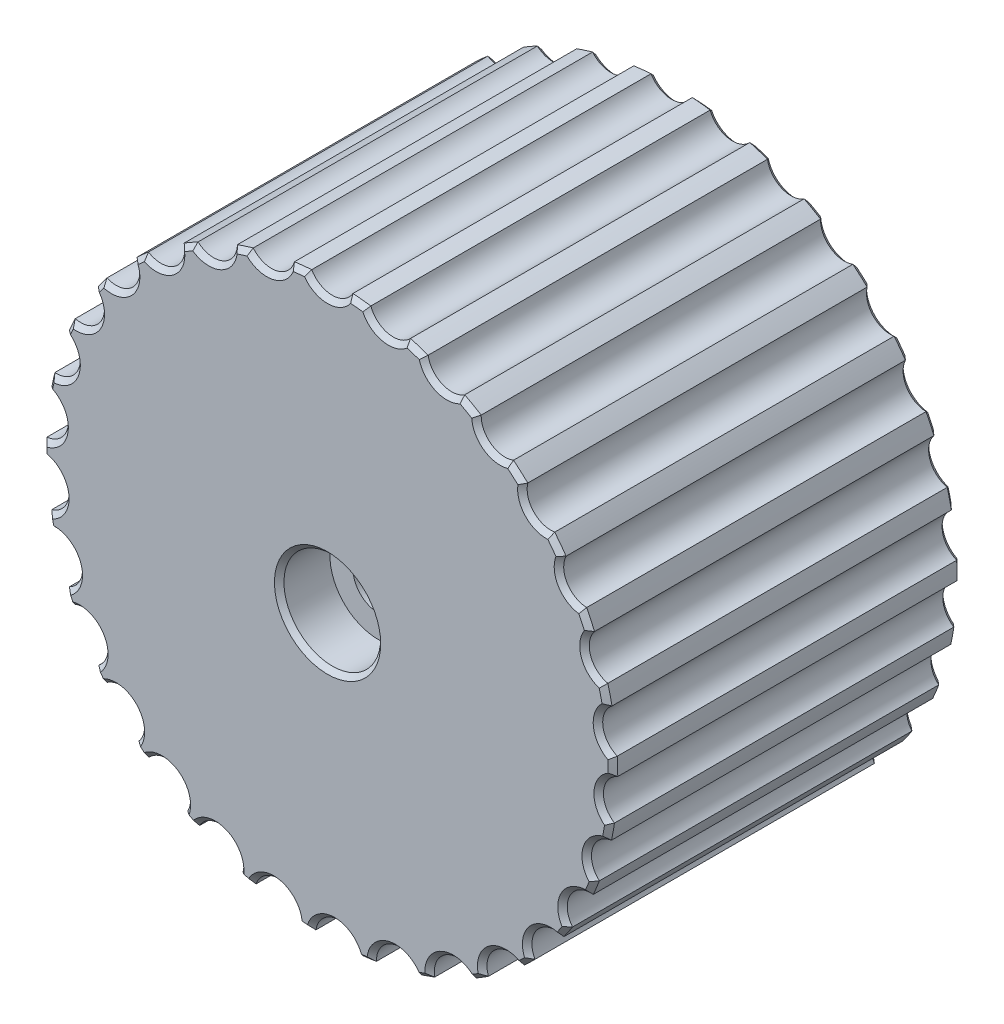
from build123d import *

# Parameters (mm, degrees)
SKIZZE1_R                       = 18
GRUNDK_RPER_DEPTH               = 14
SKIZZE3_R                       = 11.05
SITZ_KUGELLAGER_DEPTH           = 7.5
SITZ_SCHNECKENGEH_USE_START     = 8
SKIZZE4_R                       = 18
SKIZZE4_R_2                     = 15.6
SITZ_SCHNECKENGEH_USE_DEPTH     = 8
SKIZZE5_R                       = 1.6
BOHRUNG_M3_ZAPFEN_DEPTH         = 34.645207683
SKIZZE6_R                       = 3.05
SENKUNG_M3_DEPTH                = 3.2
SKIZZE7_R                       = 1.5
SCHNITT_LINEAR_AUSTRAGEN3_DEPTH = 34.645207683
FASE1_SIZE                      = 0.3
FREISCHNITTKUGELLAGER_DEPTH     = 7.5
FASE2_SIZE                      = 0.4


with BuildPart() as part:
    # Skizze1 → Grundkörper (new body)
    with BuildSketch(Plane.XY):
        Circle(SKIZZE1_R)
    extrude(amount=GRUNDK_RPER_DEPTH)

    # Skizze3 → Sitz_Kugellager (cut)
    with BuildSketch(Plane(origin=(0, 0, 0), x_dir=(-1, 0, 0), z_dir=(0, 0, -1))):
        Circle(SKIZZE3_R)
    extrude(amount=-SITZ_KUGELLAGER_DEPTH, mode=Mode.SUBTRACT)

    # Skizze4 → Sitz_SchneckenGehäuse (add)
    with BuildSketch(Plane(origin=(0, 0, 0), x_dir=(-1, 0, 0), z_dir=(0, 0, -1)).offset(SITZ_SCHNECKENGEH_USE_START)):
        Circle(SKIZZE4_R)
        Circle(SKIZZE4_R_2, mode=Mode.SUBTRACT)
    extrude(amount=-SITZ_SCHNECKENGEH_USE_DEPTH)

    # Skizze5 → Bohrung M3 Zapfen (cut, through all)
    with BuildSketch(Plane.XY.offset(14)):
        Circle(SKIZZE5_R)
    extrude(amount=-BOHRUNG_M3_ZAPFEN_DEPTH, mode=Mode.SUBTRACT)

    # Skizze6 → Senkung M3 (cut)
    with BuildSketch(Plane.XY.offset(14)):
        Circle(SKIZZE6_R)
    extrude(amount=-SENKUNG_M3_DEPTH, mode=Mode.SUBTRACT)

    # Skizze7 → Schnitt-Linear austragen3 (cut, through all)
    with BuildSketch(Plane.XY.offset(14)):
        with Locations((0, 18.7)):
            Circle(SKIZZE7_R)
        with Locations((3.840889693, 18.343624365)):
            Circle(SKIZZE7_R)
        with Locations((7.52375207, 17.196470523)):
            Circle(SKIZZE7_R)
        with Locations((10.887628372, 15.308674601)):
            Circle(SKIZZE7_R)
        with Locations((13.785501065, 12.762742339)):
            Circle(SKIZZE7_R)
        with Locations((16.090719205, 9.669943194)):
            Circle(SKIZZE7_R)
        with Locations((17.702533699, 6.16544733)):
            Circle(SKIZZE7_R)
        with Locations((18.550500518, 2.402418031)):
            Circle(SKIZZE7_R)
        with Locations((18.597559443, -1.454682263)):
            Circle(SKIZZE7_R)
        with Locations((17.841653775, -5.237279763)):
            Circle(SKIZZE7_R)
        with Locations((16.315820216, -8.780056806)):
            Circle(SKIZZE7_R)
        with Locations((14.086745017, -11.928177036)):
            Circle(SKIZZE7_R)
        with Locations((11.251849459, -14.544052492)):
            Circle(SKIZZE7_R)
        with Locations((7.935032082, -16.513356864)):
            Circle(SKIZZE7_R)
        with Locations((4.281253721, -17.750022102)):
            Circle(SKIZZE7_R)
        with Locations((0.450202022, -18.2)):
            Circle(SKIZZE7_R)
        with Locations((-3.390687671, -17.843624365)):
            Circle(SKIZZE7_R)
        with Locations((-7.073550047, -16.696470523)):
            Circle(SKIZZE7_R)
        with Locations((-10.43742635, -14.808674601)):
            Circle(SKIZZE7_R)
        with Locations((-13.335299043, -12.262742339)):
            Circle(SKIZZE7_R)
        with Locations((-15.640517183, -9.169943194)):
            Circle(SKIZZE7_R)
        with Locations((-17.252331677, -5.66544733)):
            Circle(SKIZZE7_R)
        with Locations((-18.100298496, -1.902418031)):
            Circle(SKIZZE7_R)
        with Locations((-18.147357421, 1.954682263)):
            Circle(SKIZZE7_R)
        with Locations((-17.391451752, 5.737279763)):
            Circle(SKIZZE7_R)
        with Locations((-15.865618194, 9.280056806)):
            Circle(SKIZZE7_R)
        with Locations((-13.636542995, 12.428177036)):
            Circle(SKIZZE7_R)
        with Locations((-10.801647437, 15.044052492)):
            Circle(SKIZZE7_R)
        with Locations((-7.48483006, 17.013356864)):
            Circle(SKIZZE7_R)
        with Locations((-3.831051698, 18.250022102)):
            Circle(SKIZZE7_R)
    extrude(amount=-SCHNITT_LINEAR_AUSTRAGEN3_DEPTH, mode=Mode.SUBTRACT)

    # Fase1
    fase1_edges = [part.edges().sort_by_distance(p)[0] for p in [
        (15.6, 0, -8),
        (17.102127152, -1.337711064, -8),
        (17.102127152, -1.337711064, 14),
        (16.402381555, -4.814792511, -8),
        (16.402381555, -4.814792511, 14),
        (14.994931633, -8.069245051, -8),
        (14.994931633, -8.069245051, 14),
        (12.942011218, -10.958855351, -8),
        (12.942011218, -10.958855351, 14),
        (10.33400092, -13.357648657, -8),
        (10.33400092, -13.357648657, 14),
        (7.285361892, -15.16134775, -8),
        (7.285361892, -15.16134775, 14),
        (3.929544005, -16.291838205, -8),
        (3.929544005, -16.291838205, 14),
        (0.413108807, -16.700458706, -8),
        (0.413108807, -16.700458706, 14),
        (-16.608515653, -1.745625337, -8),
        (-16.608515653, -1.745625337, 14),
        (3.533477918, 16.87546293, -8),
        (3.533477918, 16.87546293, 14),
        (6.92250395, 15.822243213, -8),
        (6.92250395, 15.822243213, 14),
        (10.018265281, 14.086296666, -8),
        (10.018265281, 14.086296666, 14),
        (12.684795951, 11.743699527, -8),
        (12.684795951, 11.743699527, 14),
        (14.805026945, 8.897288413, -8),
        (14.805026945, 8.897288413, 14),
        (16.285988352, 5.672092205, -8),
        (16.285988352, 5.672092205, 14),
        (17.062923496, 2.209766525, -8),
        (17.062923496, 2.209766525, 14),
        (-3.110664895, -16.369993731, -8),
        (-3.110664895, -16.369993731, 14),
        (-6.488412449, -15.315306525, -8),
        (-6.488412449, -15.315306525, 14),
        (-12.231166047, -11.247414644, -8),
        (-12.231166047, -11.247414644, 14),
        (-9.573272427, -13.582608535, -8),
        (-9.573272427, -13.582608535, 14),
        (-14.34651947, -8.411279949, -8),
        (-14.34651947, -8.411279949, 14),
        (-15.827206272, -5.197454187, -8),
        (-15.827206272, -5.197454187, 14),
        (-16.655983786, 1.794043911, -8),
        (-16.655983786, 1.794043911, 14),
        (-15.96696249, 5.267353874, -8),
        (-15.96696249, 5.267353874, 14),
        (-6.880792926, 15.640353171, -8),
        (-6.880792926, 15.640353171, 14),
        (-3.05, 0, 14),
        (-9.926795083, 13.825597175, -8),
        (-9.926795083, 13.825597175, 14),
        (-12.527901138, 11.417774526, -8),
        (-12.527901138, 11.417774526, 14),
        (-14.570842726, 8.522721684, -8),
        (-14.570842726, 8.522721684, 14),
        (-3.522887784, 16.782018355, -8),
        (-3.522887784, 16.782018355, 14),
        (0, 17.2, -8),
        (0, 17.2, 14),
        (17.515235554, 4.149279875, 14),
        (16.29626312, 7.644070142, 14),
        (14.391939436, 10.810739071, 14),
        (11.883403688, 13.519789821, 14),
        (8.874728972, 15.660114484, 14),
        (5.489353832, 17.142549242, 14),
        (1.866122968, 17.903004917, 14),
        (-1.845177718, 17.905175765, 14),
        (-5.488897258, 17.142695438, 14),
        (-8.909226545, 15.640514134, 14),
        (-11.956444307, 13.455238368, 14),
        (-14.493504933, 10.674189186, 14),
        (-16.402674498, 7.412979786, 14),
        (-17.591831713, 3.811490124, 14),
        (-17.99997786, 0.028231948, 14),
        (-17.601466242, -3.766747419, 14),
        (-16.408490545, -7.400097164, 14),
        (-14.471474851, -10.704037352, 14),
        (-11.87717883, -13.525258705, 14),
        (-8.74454407, -15.733179876, 14),
        (-5.218527085, -17.226925874, 14),
        (-1.462359108, -17.940499041, 14),
        (2.351181861, -17.845782243, 14),
        (6.048823012, -16.953222118, 14),
        (9.465510145, -15.310261843, 14),
        (12.452201871, -12.997794758, 14),
        (14.882310584, -10.125059589, 14),
        (16.656536218, -6.823474278, 14),
        (17.706015893, -3.239907589, 14),
        (17.993858472, 0.470167311, 14),
        (-17.591831713, 3.811490124, -8),
        (-16.402674498, 7.412979786, -8),
        (-14.493504933, 10.674189186, -8),
        (-11.956444307, 13.455238368, -8),
        (-8.909226545, 15.640514134, -8),
        (-5.488897258, 17.142695438, -8),
        (-1.845177718, 17.905175765, -8),
        (1.866122968, 17.903004917, -8),
        (5.489353832, 17.142549242, -8),
        (8.874728972, 15.660114484, -8),
        (11.883403688, 13.519789821, -8),
        (14.391939436, 10.810739071, -8),
        (16.29626312, 7.644070142, -8),
        (17.515235554, 4.149279875, -8),
        (17.993858472, 0.470167311, -8),
        (17.706015893, -3.239907589, -8),
        (16.656536218, -6.823474278, -8),
        (14.882310584, -10.125059589, -8),
        (12.452201871, -12.997794758, -8),
        (9.465510145, -15.310261843, -8),
        (6.048823012, -16.953222118, -8),
        (2.351181861, -17.845782243, -8),
        (-1.462359108, -17.940499041, -8),
        (-5.218527085, -17.226925874, -8),
        (-8.74454407, -15.733179876, -8),
        (-11.87717883, -13.525258705, -8),
        (-14.471474851, -10.704037352, -8),
        (-16.408490545, -7.400097164, -8),
        (-17.601466242, -3.766747419, -8),
        (-17.99997786, 0.028231948, -8),
    ]]
    chamfer(fase1_edges, length=FASE1_SIZE)

    # Skizze8 → FreischnittKugellager (cut)
    with BuildSketch(Plane(origin=(0, 0, 0), x_dir=(-1, 0, 0), z_dir=(0, 0, -1))):
        with BuildLine():
            Line((4.228651928, 10.208868834), (4.419993644, 10.670808601))
            ThreePointArc((4.419993644, 10.670808601), (0, 11.55), (-4.419993644, 10.670808601))
            Line((-4.419993644, 10.670808601), (-4.228651928, 10.208868834))
            ThreePointArc((-4.228651928, 10.208868834), (-5.525, 9.569580712), (-6.726813791, 8.76655441))
            Line((-6.726813791, 8.76655441), (-7.031194505, 9.16323108))
            ThreePointArc((-7.031194505, 9.16323108), (-10.002593414, 5.775), (-11.451188149, 1.50757752))
            Line((-11.451188149, 1.50757752), (-10.955465718, 1.442314424))
            ThreePointArc((-10.955465718, 1.442314424), (-11.05, 0), (-10.955465718, -1.442314424))
            Line((-10.955465718, -1.442314424), (-11.451188149, -1.50757752))
            ThreePointArc((-11.451188149, -1.50757752), (-10.002593414, -5.775), (-7.031194505, -9.16323108))
            Line((-7.031194505, -9.16323108), (-6.726813791, -8.76655441))
            ThreePointArc((-6.726813791, -8.76655441), (-5.525, -9.569580712), (-4.228651928, -10.208868834))
            Line((-4.228651928, -10.208868834), (-4.419993644, -10.670808601))
            ThreePointArc((-4.419993644, -10.670808601), (0, -11.55), (4.419993644, -10.670808601))
            Line((4.419993644, -10.670808601), (4.228651928, -10.208868834))
            ThreePointArc((4.228651928, -10.208868834), (5.525, -9.569580712), (6.726813791, -8.76655441))
            Line((6.726813791, -8.76655441), (7.031194505, -9.16323108))
            ThreePointArc((7.031194505, -9.16323108), (10.002593414, -5.775), (11.451188149, -1.50757752))
            Line((11.451188149, -1.50757752), (10.955465718, -1.442314424))
            ThreePointArc((10.955465718, -1.442314424), (11.05, 0), (10.955465718, 1.442314424))
            Line((10.955465718, 1.442314424), (11.451188149, 1.50757752))
            ThreePointArc((11.451188149, 1.50757752), (10.002593414, 5.775), (7.031194505, 9.16323108))
            Line((7.031194505, 9.16323108), (6.726813791, 8.76655441))
            ThreePointArc((6.726813791, 8.76655441), (5.525, 9.569580712), (4.228651928, 10.208868834))
        make_face()
    extrude(amount=-FREISCHNITTKUGELLAGER_DEPTH, mode=Mode.SUBTRACT)

    # Fase2
    fase2_edges = [part.edges().sort_by_distance(p)[0] for p in [
        (-5.525, 9.569580712, 0),
        (5.525, 9.569580712, 0),
        (11.05, 0, 0),
        (5.525, -9.569580712, 0),
        (-5.525, -9.569580712, 0),
        (-11.05, 0, 0),
    ]]
    chamfer(fase2_edges, length=FASE2_SIZE)


solid = part.part
